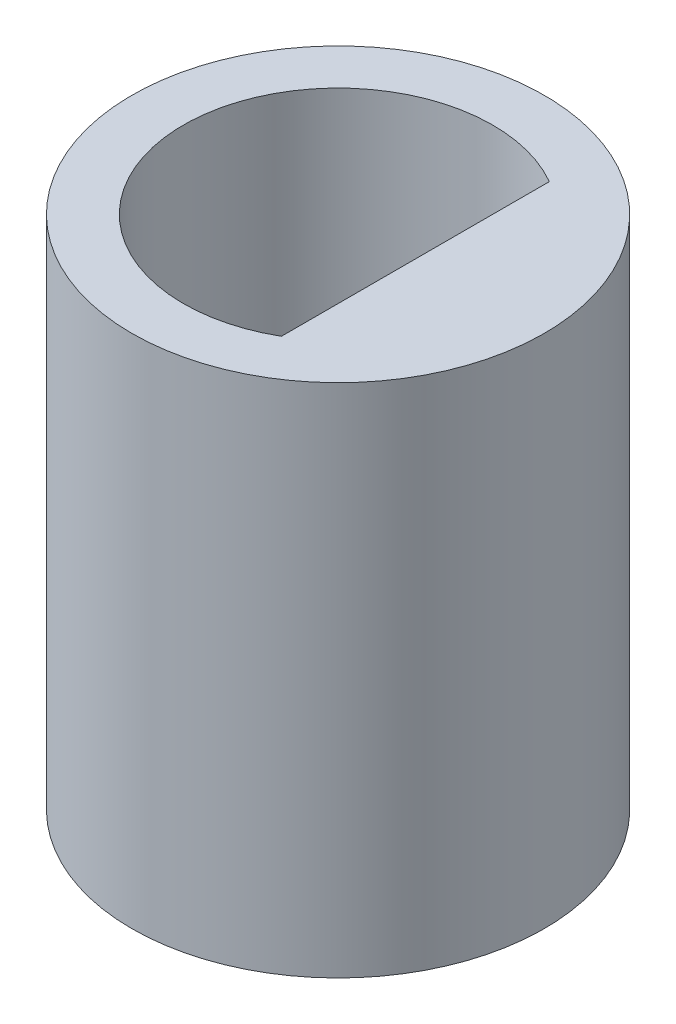
from build123d import *

# Parameters (mm, degrees)
SKETCH1_R           = 4
BOSS_EXTRUDE1_DEPTH = 10


with BuildPart() as part:
    # Sketch1 → Boss-Extrude1 (new body)
    with BuildSketch(Plane(origin=(0, 0, 0), x_dir=(1, 0, 0), z_dir=(0, 1, 0))):
        with Locations(Location((0, 0, 0), (0, 0, 270))):
            Circle(SKETCH1_R)
        with BuildLine():
            Line((1.5, 2.598076211), (1.5, -2.598076211))
            ThreePointArc((1.5, -2.598076211), (-3, 0), (1.5, 2.598076211))
        make_face(mode=Mode.SUBTRACT)
    extrude(amount=BOSS_EXTRUDE1_DEPTH)


solid = part.part
